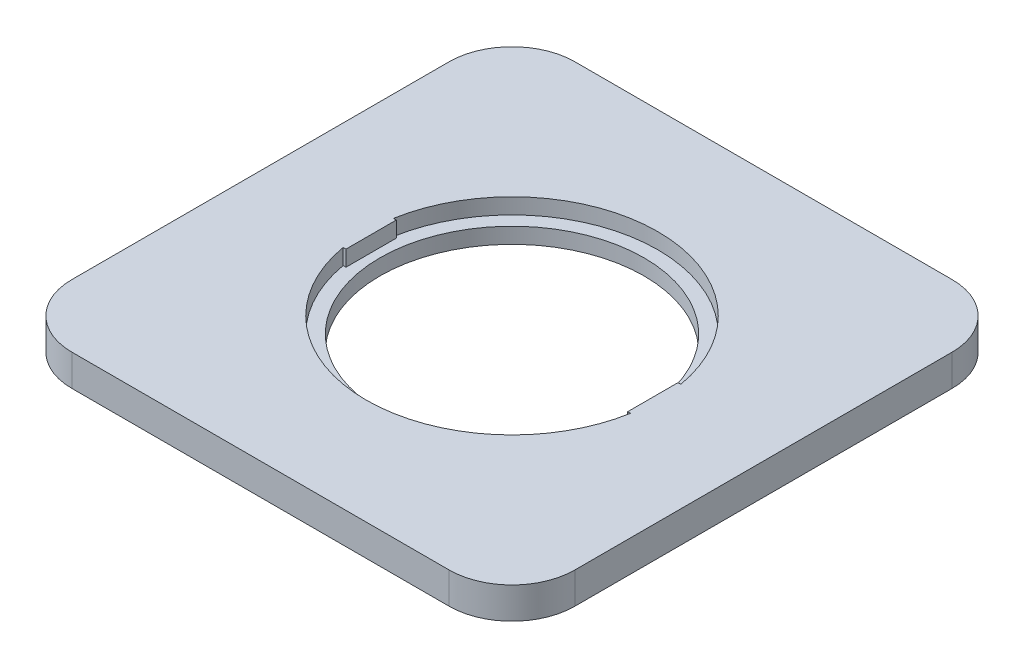
from build123d import *

# Parameters (mm, degrees)
BOSS_EXTRUDE1_DEPTH = 5
SKETCH2_R           = 21
CUT_EXTRUDE1_DEPTH  = 8
SKETCH3_R           = 23.2
CUT_EXTRUDE2_DEPTH  = 2.5
BOSS_EXTRUDE2_START = 2.5
BOSS_EXTRUDE2_DEPTH = 2.5


with BuildPart() as part:
    # Sketch1 → Boss-Extrude1 (new body)
    with BuildSketch(Plane(origin=(0, 0, 0), x_dir=(1, 0, 0), z_dir=(0, 1, 0))):
        with BuildLine():
            Line((-30, -40), (30, -40))
            ThreePointArc((30, -40), (37.071067812, -37.071067812), (40, -30))
            Line((40, -30), (40, 30))
            ThreePointArc((40, 30), (37.071067812, 37.071067812), (30, 40))
            Line((30, 40), (-30, 40))
            ThreePointArc((-30, 40), (-37.071067812, 37.071067812), (-40, 30))
            Line((-40, 30), (-40, -30))
            ThreePointArc((-40, -30), (-37.071067812, -37.071067812), (-30, -40))
        make_face()
    extrude(amount=BOSS_EXTRUDE1_DEPTH)

    # Sketch2 → Cut-Extrude1 (cut)
    with BuildSketch(Plane(origin=(0, 5, 0), x_dir=(1, 0, 0), z_dir=(0, 1, 0))):
        with Locations(Location((0, 0, 0), (0, 0, 270))):
            Circle(SKETCH2_R)
    extrude(amount=-CUT_EXTRUDE1_DEPTH, mode=Mode.SUBTRACT)

    # Sketch3 → Cut-Extrude2 (cut)
    with BuildSketch(Plane(origin=(0, 5, 0), x_dir=(1, 0, 0), z_dir=(0, 1, 0))):
        with Locations(Location((0, 0, 0), (0, 0, 270))):
            Circle(SKETCH3_R)
    extrude(amount=-CUT_EXTRUDE2_DEPTH, mode=Mode.SUBTRACT)

    # Sketch4 → Boss-Extrude2 (add)
    with BuildSketch(Plane(origin=(0, 2.5, 0), x_dir=(1, 0, 0), z_dir=(0, 1, 0)).offset(BOSS_EXTRUDE2_START)):
        with BuildLine():
            Line((-22.4, 4), (-22.852570971, 4))
            ThreePointArc((-22.852570971, 4), (-23.112979541, 2.007530008), (-23.2, 0))
            ThreePointArc((-23.2, 0), (-23.112979541, -2.007530008), (-22.852570971, -4))
            Line((-22.852570971, -4), (-22.4, -4))
            Line((-22.4, -4), (-22.4, 4))
        make_face()
        Polygon((23.2, 0), (23.2, 4), (22.4, 4), (22.4, -4), (23.2, -4), align=None)
    extrude(amount=-BOSS_EXTRUDE2_DEPTH)


solid = part.part
